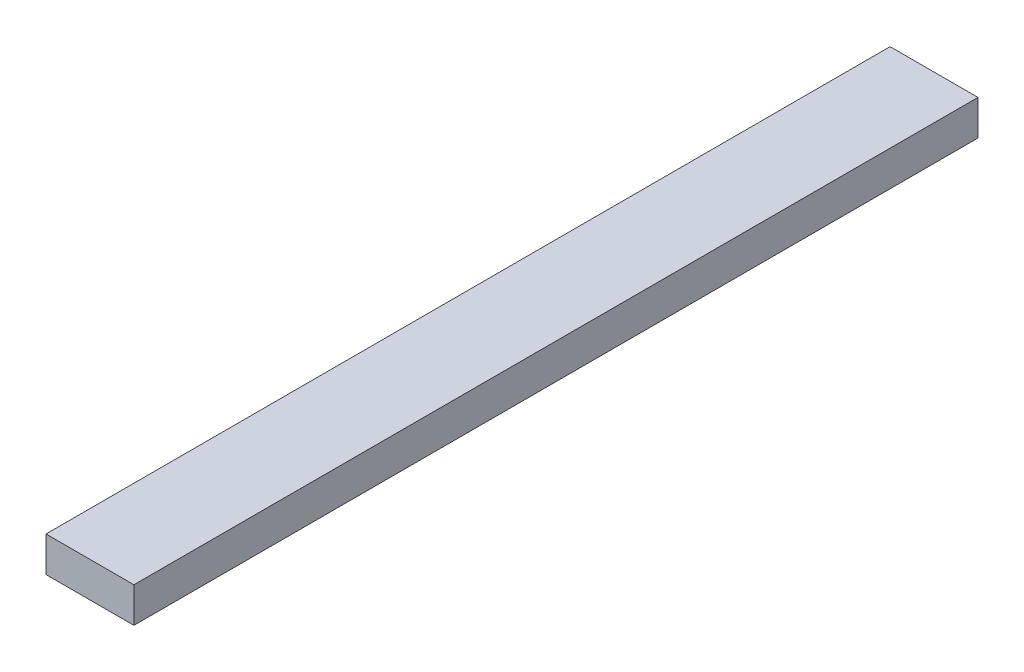
from build123d import *

# Parameters (mm, degrees)
SKETCH1_W           = 31.75
SKETCH1_H           = 12.7
BOSS_EXTRUDE1_DEPTH = 304.8


with BuildPart() as part:
    # Sketch1 → Boss-Extrude1 (new body)
    with BuildSketch(Plane.XY):
        with Locations((15.875, 6.35)):
            Rectangle(SKETCH1_W, SKETCH1_H)
    extrude(amount=BOSS_EXTRUDE1_DEPTH)


solid = part.part
